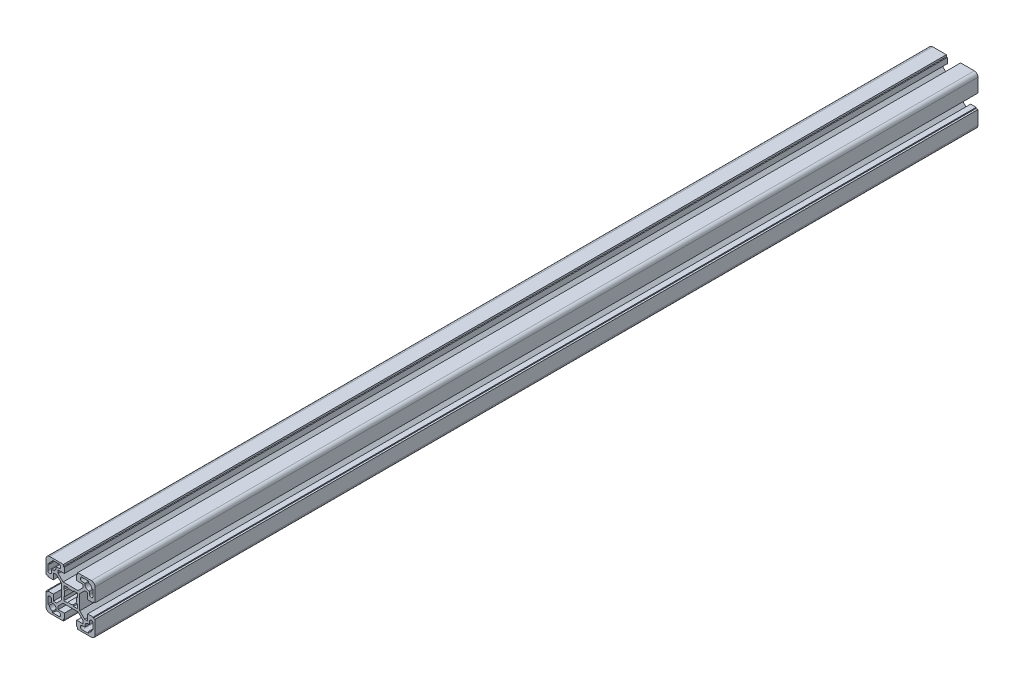
from build123d import *

# Parameters (mm, degrees)
EXTRUDE1_DEPTH = 720


with BuildPart() as part:
    # Sketch1 → Extrude1 (new body)
    with BuildSketch(Plane.XY):
        with BuildLine():
            Line((5.8, -20), (17, -20))
            ThreePointArc((17, -20), (19.121320344, -19.121320344), (20, -17))
            Line((20, -17), (20, -5.8))
            Line((20, -5.8), (18.5, -5.8))
            Line((18.5, -5.8), (18.5, -5))
            Line((18.5, -5), (14, -5))
            Line((14, -5), (14, -10.05))
            Line((14, -10.05), (11.464213562, -10.05))
            Line((11.464213562, -10.05), (7.5, -6.085786438))
            Line((7.5, -6.085786438), (7.5, 6.085786438))
            Line((7.5, 6.085786438), (11.464213562, 10.05))
            Line((11.464213562, 10.05), (14, 10.05))
            Line((14, 10.05), (14, 5))
            Line((14, 5), (18.5, 5))
            Line((18.5, 5), (18.5, 5.8))
            Line((18.5, 5.8), (20, 5.8))
            Line((20, 5.8), (20, 17))
            ThreePointArc((20, 17), (19.121320344, 19.121320344), (17, 20))
            Line((17, 20), (5.8, 20))
            Line((5.8, 20), (5.8, 18.5))
            Line((5.8, 18.5), (5, 18.5))
            Line((5, 18.5), (5, 14))
            Line((5, 14), (10.05, 14))
            Line((10.05, 14), (10.05, 11.464213562))
            Line((10.05, 11.464213562), (6.085786438, 7.5))
            Line((6.085786438, 7.5), (-6.085786438, 7.5))
            Line((-6.085786438, 7.5), (-10.05, 11.464213562))
            Line((-10.05, 11.464213562), (-10.05, 14))
            Line((-10.05, 14), (-5, 14))
            Line((-5, 14), (-5, 18.5))
            Line((-5, 18.5), (-5.8, 18.5))
            Line((-5.8, 18.5), (-5.8, 20))
            Line((-5.8, 20), (-17, 20))
            ThreePointArc((-17, 20), (-19.121320344, 19.121320344), (-20, 17))
            Line((-20, 17), (-20, 5.8))
            Line((-20, 5.8), (-18.5, 5.8))
            Line((-18.5, 5.8), (-18.5, 5))
            Line((-18.5, 5), (-14, 5))
            Line((-14, 5), (-14, 10.05))
            Line((-14, 10.05), (-11.464213562, 10.05))
            Line((-11.464213562, 10.05), (-7.5, 6.085786438))
            Line((-7.5, 6.085786438), (-7.5, -6.085786438))
            Line((-7.5, -6.085786438), (-11.464213562, -10.05))
            Line((-11.464213562, -10.05), (-14, -10.05))
            Line((-14, -10.05), (-14, -5))
            Line((-14, -5), (-18.5, -5))
            Line((-18.5, -5), (-18.5, -5.8))
            Line((-18.5, -5.8), (-20, -5.8))
            Line((-20, -5.8), (-20, -17))
            ThreePointArc((-20, -17), (-19.121320344, -19.121320344), (-17, -20))
            Line((-17, -20), (-5.8, -20))
            Line((-5.8, -20), (-5.8, -18.5))
            Line((-5.8, -18.5), (-5, -18.5))
            Line((-5, -18.5), (-5, -14))
            Line((-5, -14), (-10.05, -14))
            Line((-10.05, -14), (-10.05, -11.464213562))
            Line((-10.05, -11.464213562), (-6.085786438, -7.5))
            Line((-6.085786438, -7.5), (6.085786438, -7.5))
            Line((6.085786438, -7.5), (10.05, -11.464213562))
            Line((10.05, -11.464213562), (10.05, -14))
            Line((10.05, -14), (5, -14))
            Line((5, -14), (5, -18.5))
            Line((5, -18.5), (5.8, -18.5))
            Line((5.8, -18.5), (5.8, -20))
        make_face()
        with BuildLine():
            Line((14.5, -18.5), (9.5, -18.5))
            ThreePointArc((9.5, -18.5), (8, -17), (9.5, -15.5))
            Line((9.5, -15.5), (11.75, -15.5))
            Line((11.75, -15.5), (11.75, -14.5))
            ThreePointArc((11.75, -14.5), (12.555456352, -12.555456352), (14.5, -11.75))
            Line((14.5, -11.75), (15.5, -11.75))
            Line((15.5, -11.75), (15.5, -9.5))
            ThreePointArc((15.5, -9.5), (17, -8), (18.5, -9.5))
            Line((18.5, -9.5), (18.5, -14.5))
            Line((18.5, -14.5), (17.25, -14.5))
            ThreePointArc((17.25, -14.5), (16.444543648, -16.444543648), (14.5, -17.25))
            Line((14.5, -17.25), (14.5, -18.5))
        make_face(mode=Mode.SUBTRACT)
        with BuildLine():
            Line((18.5, 14.5), (17.25, 14.5))
            ThreePointArc((17.25, 14.5), (16.444543648, 16.444543648), (14.5, 17.25))
            Line((14.5, 17.25), (14.5, 18.5))
            Line((14.5, 18.5), (9.5, 18.5))
            ThreePointArc((9.5, 18.5), (8, 17), (9.5, 15.5))
            Line((9.5, 15.5), (11.75, 15.5))
            Line((11.75, 15.5), (11.75, 14.5))
            ThreePointArc((11.75, 14.5), (12.555456352, 12.555456352), (14.5, 11.75))
            Line((14.5, 11.75), (15.5, 11.75))
            Line((15.5, 11.75), (15.5, 9.5))
            ThreePointArc((15.5, 9.5), (17, 8), (18.5, 9.5))
            Line((18.5, 9.5), (18.5, 14.5))
        make_face(mode=Mode.SUBTRACT)
        with BuildLine():
            Line((5.5, 5.5), (2.397915762, 5.5))
            Line((2.397915762, 5.5), (1.998263135, 4.583333333))
            ThreePointArc((1.998263135, 4.583333333), (0, 5), (-1.998263135, 4.583333333))
            Line((-1.998263135, 4.583333333), (-2.397915762, 5.5))
            Line((-2.397915762, 5.5), (-5.5, 5.5))
            Line((-5.5, 5.5), (-5.5, 2.397915762))
            Line((-5.5, 2.397915762), (-4.583333333, 1.998263135))
            ThreePointArc((-4.583333333, 1.998263135), (-5, 0), (-4.583333333, -1.998263135))
            Line((-4.583333333, -1.998263135), (-5.5, -2.397915762))
            Line((-5.5, -2.397915762), (-5.5, -5.5))
            Line((-5.5, -5.5), (-2.397915762, -5.5))
            Line((-2.397915762, -5.5), (-1.998263135, -4.583333333))
            ThreePointArc((-1.998263135, -4.583333333), (0, -5), (1.998263135, -4.583333333))
            Line((1.998263135, -4.583333333), (2.397915762, -5.5))
            Line((2.397915762, -5.5), (5.5, -5.5))
            Line((5.5, -5.5), (5.5, -2.397915762))
            Line((5.5, -2.397915762), (4.583333333, -1.998263135))
            ThreePointArc((4.583333333, -1.998263135), (5, 0), (4.583333333, 1.998263135))
            Line((4.583333333, 1.998263135), (5.5, 2.397915762))
            Line((5.5, 2.397915762), (5.5, 5.5))
        make_face(mode=Mode.SUBTRACT)
        with BuildLine():
            Line((-18.5, -14.5), (-17.25, -14.5))
            ThreePointArc((-17.25, -14.5), (-16.444543648, -16.444543648), (-14.5, -17.25))
            Line((-14.5, -17.25), (-14.5, -18.5))
            Line((-14.5, -18.5), (-9.5, -18.5))
            ThreePointArc((-9.5, -18.5), (-8, -17), (-9.5, -15.5))
            Line((-9.5, -15.5), (-11.75, -15.5))
            Line((-11.75, -15.5), (-11.75, -14.5))
            ThreePointArc((-11.75, -14.5), (-12.555456352, -12.555456352), (-14.5, -11.75))
            Line((-14.5, -11.75), (-15.5, -11.75))
            Line((-15.5, -11.75), (-15.5, -9.5))
            ThreePointArc((-15.5, -9.5), (-17, -8), (-18.5, -9.5))
            Line((-18.5, -9.5), (-18.5, -14.5))
        make_face(mode=Mode.SUBTRACT)
        with BuildLine():
            Line((-14.5, 18.5), (-9.5, 18.5))
            ThreePointArc((-9.5, 18.5), (-8, 17), (-9.5, 15.5))
            Line((-9.5, 15.5), (-11.75, 15.5))
            Line((-11.75, 15.5), (-11.75, 14.5))
            ThreePointArc((-11.75, 14.5), (-12.555456352, 12.555456352), (-14.5, 11.75))
            Line((-14.5, 11.75), (-15.5, 11.75))
            Line((-15.5, 11.75), (-15.5, 9.5))
            ThreePointArc((-15.5, 9.5), (-17, 8), (-18.5, 9.5))
            Line((-18.5, 9.5), (-18.5, 14.5))
            Line((-18.5, 14.5), (-17.25, 14.5))
            ThreePointArc((-17.25, 14.5), (-16.444543648, 16.444543648), (-14.5, 17.25))
            Line((-14.5, 17.25), (-14.5, 18.5))
        make_face(mode=Mode.SUBTRACT)
    extrude(amount=EXTRUDE1_DEPTH)


solid = part.part
